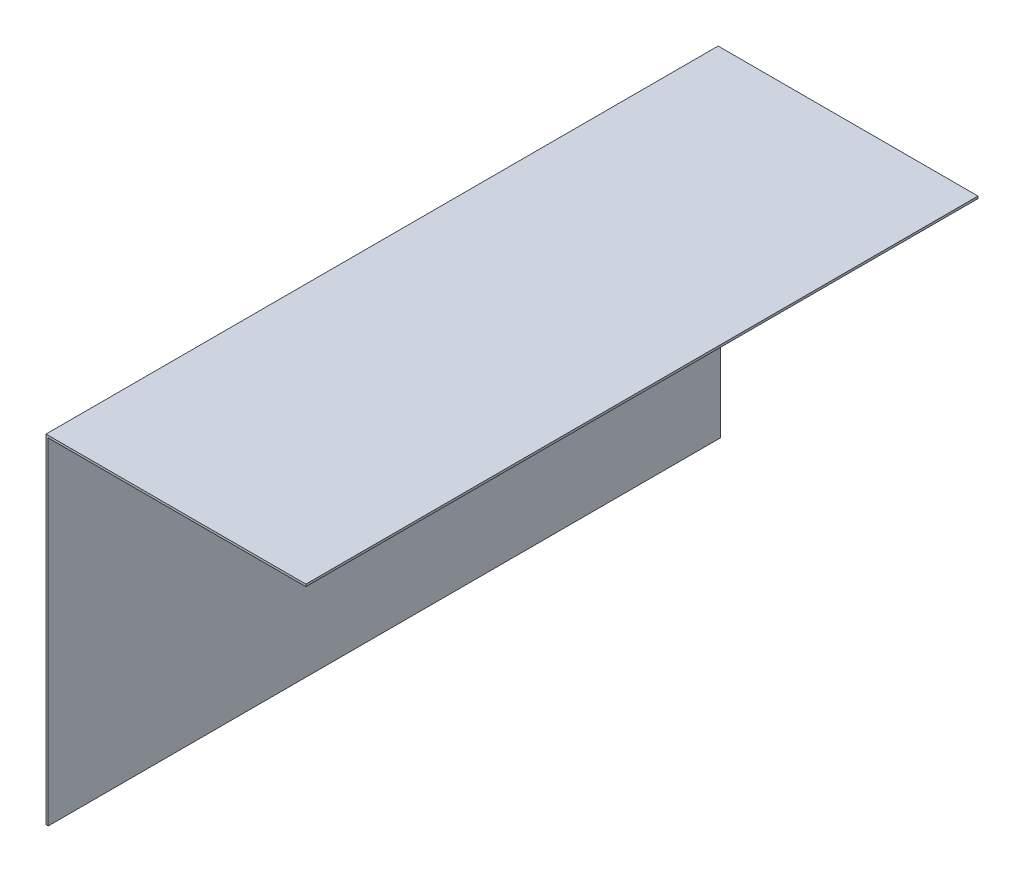
from build123d import *

# Parameters (mm, degrees)
SALIENTE_EXTRUIR1_DEPTH = 600


with BuildPart() as part:
    # Croquis1 → Saliente-Extruir1 (new body)
    with BuildSketch(Plane.XY):
        Polygon((0, 0), (230, 0), (230, 2), (-2, 2), (-2, -300), (0, -300), align=None)
    extrude(amount=SALIENTE_EXTRUIR1_DEPTH)


solid = part.part
